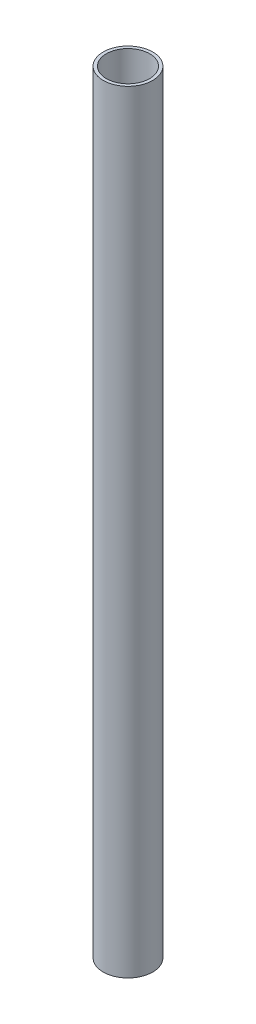
from build123d import *

# Parameters (mm, degrees)
SKETCH1_R           = 8
SKETCH1_R_2         = 7
BOSS_EXTRUDE1_DEPTH = 250


with BuildPart() as part:
    # Sketch1 → Boss-Extrude1 (new body)
    with BuildSketch(Plane(origin=(0, 0, 0), x_dir=(1, 0, 0), z_dir=(0, 1, 0))):
        with Locations(Location((0, 0, 0), (0, 0, 270))):
            Circle(SKETCH1_R)
        with Locations(Location((0, 0, 0), (0, 0, 270))):
            Circle(SKETCH1_R_2, mode=Mode.SUBTRACT)
    extrude(amount=BOSS_EXTRUDE1_DEPTH)


solid = part.part
